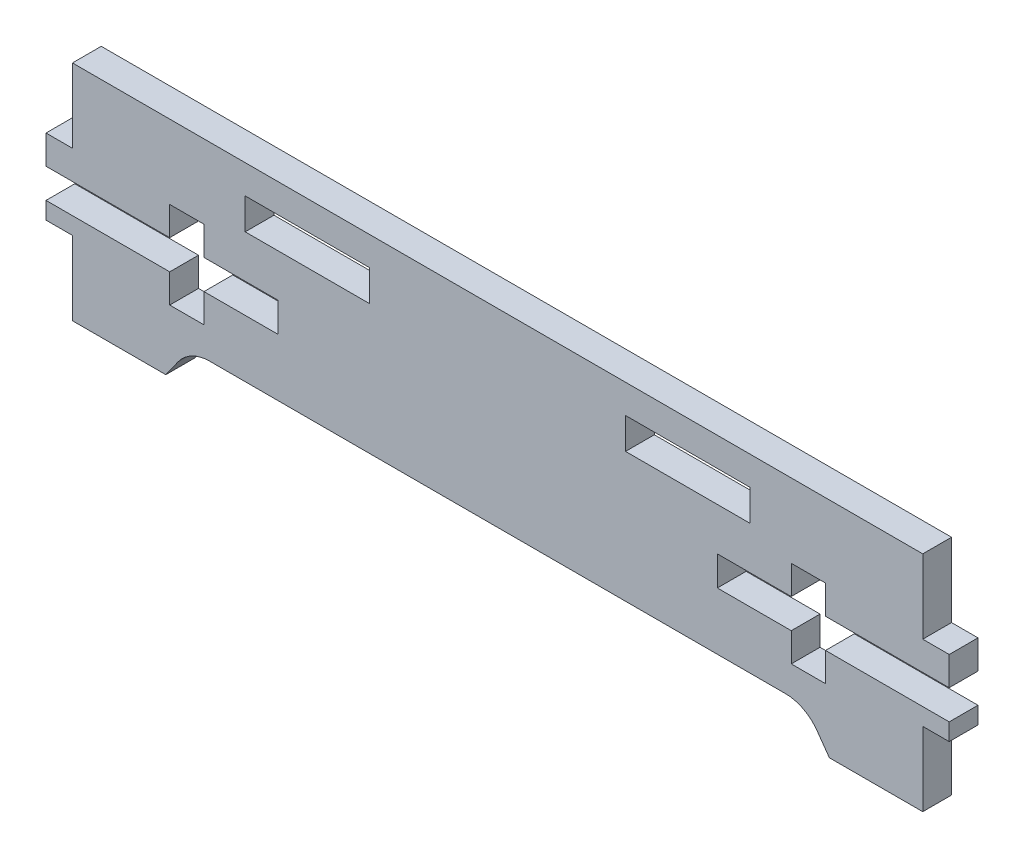
from build123d import *

# Parameters (mm, degrees)
BOSS_EXTRUDE1_DEPTH = 3.7
FILLET1_R           = 5
SKETCH3_W           = 16
SKETCH3_H           = 4
CUT_EXTRUDE1_DEPTH  = 62.374947331


with BuildPart() as part:
    # Sketch2 → Boss-Extrude1 (new body)
    with BuildSketch(Plane.XY):
        Polygon((-54.64, 19.610011726), (54.64, 19.610011726), (54.64, 10.110011726), (58.04, 10.110011726), (58.04, 6.410011726), (42.14, 6.410011726), (42.14, 10.110011726), (37.74, 10.110011726), (37.74, 6.410011726), (28.24, 6.410011726), (28.24, 2.610011726), (37.74, 2.610011726), (37.74, -1.089988274), (42.14, -1.089988274), (42.14, 2.610011726), (58.04, 2.610011726), (58.04, 0.410011726), (54.64, 0.410011726), (54.64, -9.089988274), (42.64, -9.089988274), (39.572296355, -4.769343347), (-39.572296355, -4.769343347), (-42.64, -9.089988274), (-54.64, -9.089988274), (-54.64, 0.410011726), (-58.04, 0.410011726), (-58.04, 2.610011726), (-42.14, 2.610011726), (-42.14, -1.089988274), (-37.74, -1.089988274), (-37.74, 2.610011726), (-28.24, 2.610011726), (-28.24, 6.410011726), (-37.74, 6.410011726), (-37.74, 10.110011726), (-42.14, 10.110011726), (-42.14, 6.410011726), (-58.04, 6.410011726), (-58.04, 10.110011726), (-54.64, 10.110011726), align=None)
    extrude(amount=BOSS_EXTRUDE1_DEPTH)

    # Fillet1
    fillet1_edges = [part.edges().sort_by_distance(p)[0] for p in [
        (39.572296355, -4.769343347, 1.85),
        (-39.572296355, -4.769343347, 1.85),
    ]]
    fillet(fillet1_edges, radius=FILLET1_R)

    # Sketch3 → Cut-Extrude1 (cut, through all)
    with BuildSketch(Plane.XY.offset(3.7)):
        with Locations((24.44, 13.910011726)):
            Rectangle(SKETCH3_W, SKETCH3_H)
        with Locations((-24.44, 13.910011726)):
            Rectangle(SKETCH3_W, SKETCH3_H)
    extrude(amount=-CUT_EXTRUDE1_DEPTH, mode=Mode.SUBTRACT)


solid = part.part
